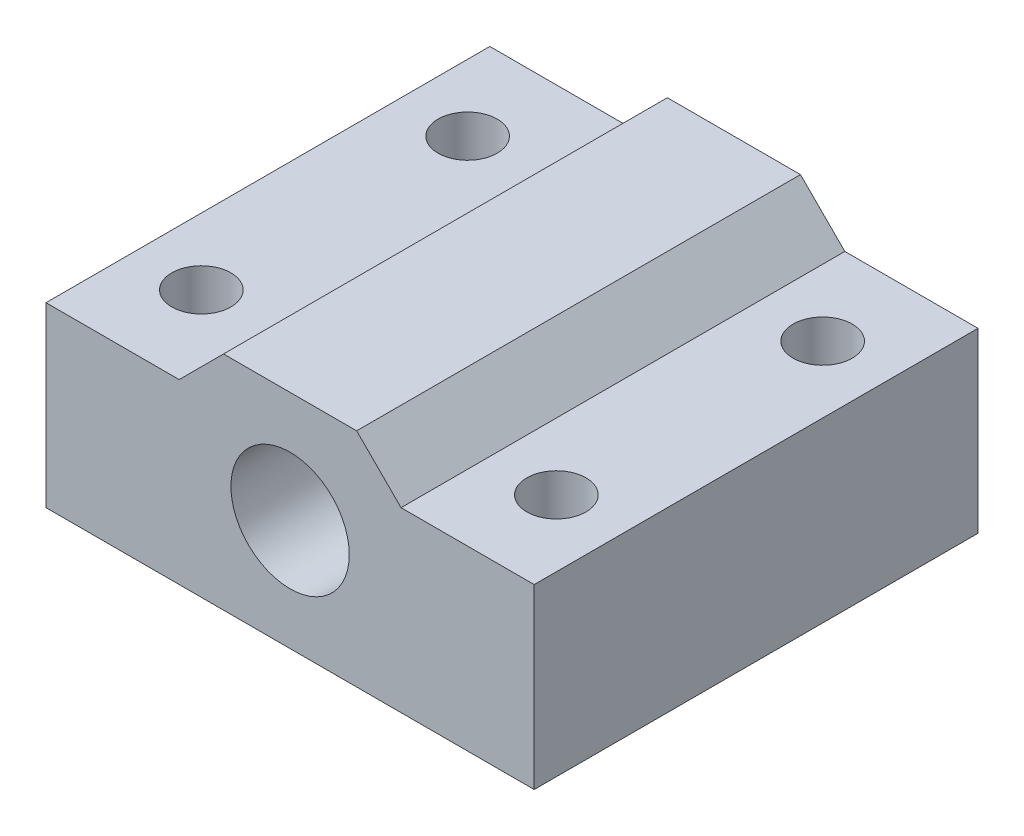
from build123d import *

# Parameters (mm, degrees)
ESQUISSE1_W             = 33
ESQUISSE1_H             = 30
BOSS_EXTRU_1_DEPTH      = 15
ESQUISSE2_R             = 4
ENL_V_MAT_EXTRU_1_DEPTH = 38.379807383
ENL_V_MAT_EXTRU_2_DEPTH = 38.379807383
ESQUISSE4_R             = 2
ENL_V_MAT_EXTRU_3_DEPTH = 26.322914524


with BuildPart() as part:
    # Esquisse1 → Boss.-Extru.1 (new body)
    with BuildSketch(Plane(origin=(0, 0, 0), x_dir=(1, 0, 0), z_dir=(0, 1, 0))):
        Rectangle(ESQUISSE1_W, ESQUISSE1_H)
    extrude(amount=BOSS_EXTRU_1_DEPTH)

    # Esquisse2 → Enlèv. mat.-Extru.1 (cut, through all)
    with BuildSketch(Plane.XY.offset(15)):
        with Locations((0, 7.5)):
            Circle(ESQUISSE2_R)
    extrude(amount=-ENL_V_MAT_EXTRU_1_DEPTH, mode=Mode.SUBTRACT)

    # Esquisse3 → Enlèv. mat.-Extru.2 (cut, through all)
    with BuildSketch(Plane.XY.offset(15)):
        Polygon((-16.5, 15), (-16.5, 12), (-7.5, 12), (-4.5, 15), align=None)
    enl_v_mat_extru_2 = extrude(amount=-ENL_V_MAT_EXTRU_2_DEPTH, mode=Mode.SUBTRACT)

    # Symétrie1: Enlèv. mat.-Extru.2 across plane
    add(enl_v_mat_extru_2.mirror(Plane(origin=(0, 0, 0), x_dir=(0, 0, 1), z_dir=(1, 0, 0))), mode=Mode.SUBTRACT)

    # Esquisse4 → Enlèv. mat.-Extru.3 (cut, through all)
    with BuildSketch(Plane(origin=(0, 12, 0), x_dir=(1, 0, 0), z_dir=(0, 1, 0))):
        with Locations(Location((-12, 9, 0), (0, 0, 270))):
            Circle(ESQUISSE4_R)
        with Locations(Location((12, 9, 0), (0, 0, 270))):
            Circle(ESQUISSE4_R)
        with Locations(Location((-12, -9, 0), (0, 0, 270))):
            Circle(ESQUISSE4_R)
        with Locations(Location((12, -9, 0), (0, 0, 270))):
            Circle(ESQUISSE4_R)
    extrude(amount=-ENL_V_MAT_EXTRU_3_DEPTH, mode=Mode.SUBTRACT)


solid = part.part
